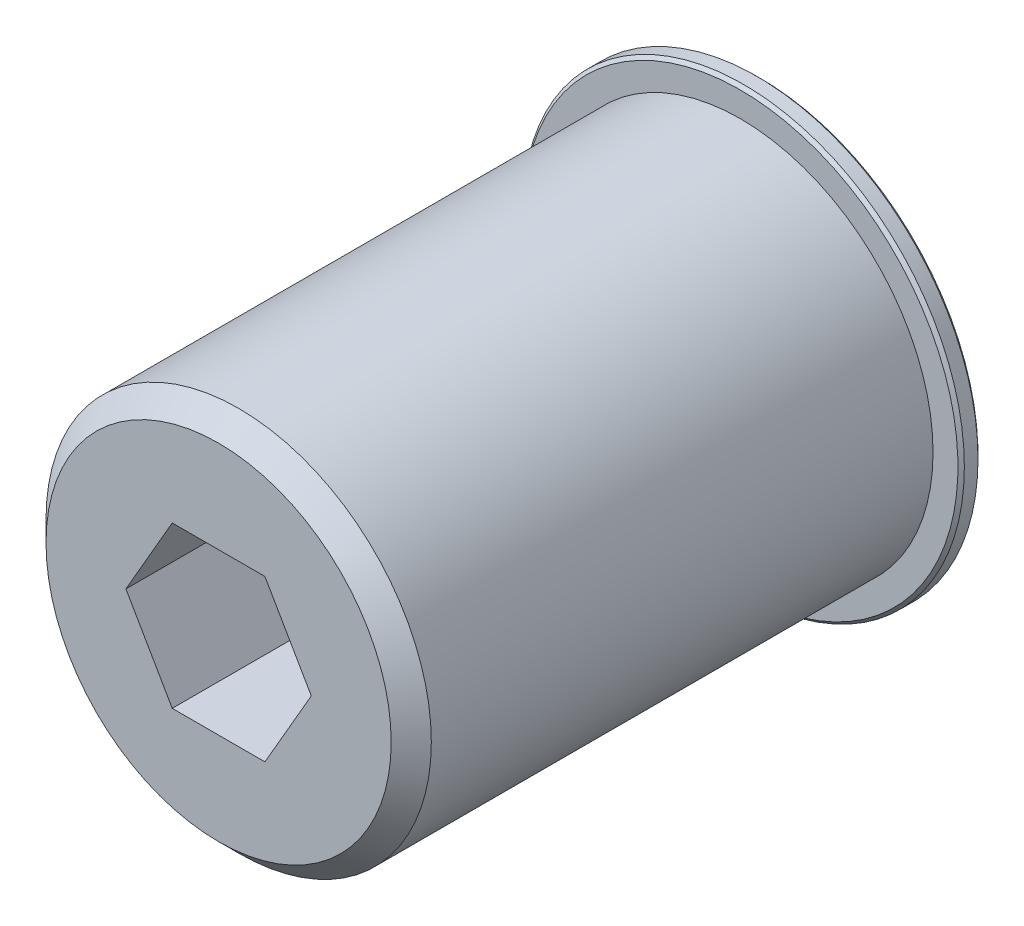
from build123d import *

# Parameters (mm, degrees)
SKETCH1_R           = 15.24
BOSS_EXTRUDE1_DEPTH = 20.6375
CHAMFER1_SIZE       = 1.5875
SKETCH2_R           = 17.4625
BOSS_EXTRUDE2_DEPTH = 1.5875
CUT_EXTRUDE1_DEPTH  = 50.467885732
CHAMFER2_SIZE       = 0.254


with BuildPart() as part:
    # Sketch1 → Boss-Extrude1 (new, symmetric)
    with BuildSketch(Plane.XY):
        Circle(SKETCH1_R)
    extrude(amount=BOSS_EXTRUDE1_DEPTH, both=True)

    # Chamfer1
    chamfer1_edges = [part.edges().sort_by_distance(p)[0] for p in [
        (-15.24, 0, 20.6375),
    ]]
    chamfer(chamfer1_edges, length=CHAMFER1_SIZE)

    # Sketch2 → Boss-Extrude2 (add)
    with BuildSketch(Plane(origin=(0, 0, -20.6375), x_dir=(-1, 0, 0), z_dir=(0, 0, -1))):
        Circle(SKETCH2_R)
    extrude(amount=BOSS_EXTRUDE2_DEPTH)

    # Sketch3 → Cut-Extrude1 (cut, through all)
    with BuildSketch(Plane(origin=(0, 0, -22.225), x_dir=(-1, 0, 0), z_dir=(0, 0, -1))):
        Polygon((7.332348419, 0), (3.666174209, 6.35), (-3.666174209, 6.35), (-7.332348419, 0), (-3.666174209, -6.35), (3.666174209, -6.35), align=None)
    extrude(amount=-CUT_EXTRUDE1_DEPTH, mode=Mode.SUBTRACT)

    # Chamfer2
    chamfer2_edges = [part.edges().sort_by_distance(p)[0] for p in [
        (17.4625, 0, -20.6375),
        (17.4625, 0, -22.225),
    ]]
    chamfer(chamfer2_edges, length=CHAMFER2_SIZE)


solid = part.part
